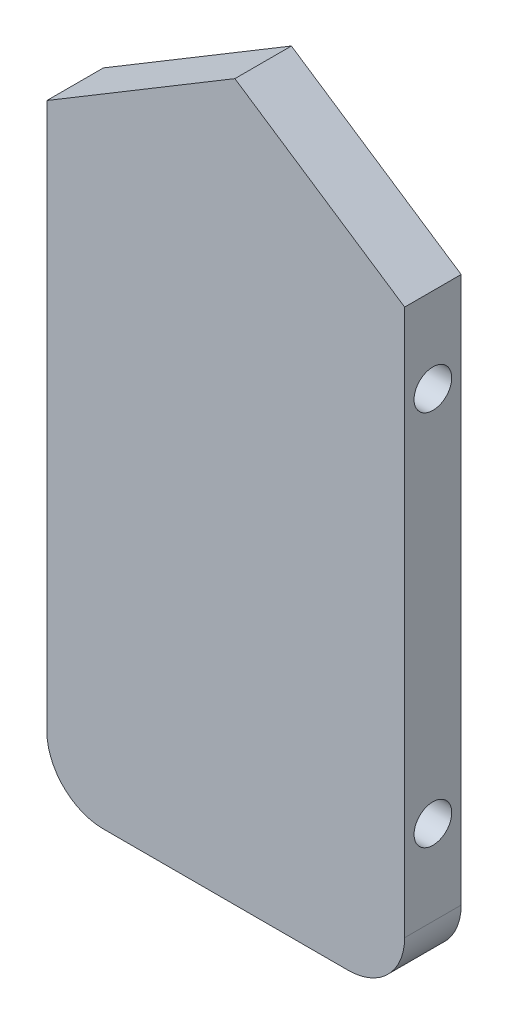
from build123d import *

# Parameters (mm, degrees)
BOSS_EXTRUDE1_DEPTH = 38.1
SKETCH4_R           = 25.4
CUT_EXTRUDE1_DEPTH  = 684.562089353


with BuildPart() as part:
    # Sketch3 → Boss-Extrude1 (new, symmetric)
    with BuildSketch(Plane.XY):
        with BuildLine():
            Line((-228.6, -406.4), (-228.6, 330.2))
            Line((-228.6, 330.2), (25.03619311, 482.6))
            Line((25.03619311, 482.6), (254, 330.2))
            Line((254, 330.2), (254, -406.4))
            ThreePointArc((254, -406.4), (231.681536726, -460.281536726), (177.8, -482.6))
            Line((177.8, -482.6), (-152.4, -482.6))
            ThreePointArc((-152.4, -482.6), (-206.281536726, -460.281536726), (-228.6, -406.4))
        make_face()
    extrude(amount=BOSS_EXTRUDE1_DEPTH, both=True)

    # Sketch4 → Cut-Extrude1 (cut, through all)
    with BuildSketch(Plane.ZY.offset(228.6)):
        with Locations((0, 215.9)):
            Circle(SKETCH4_R)
        with Locations((0, -292.1)):
            Circle(SKETCH4_R)
    extrude(amount=-CUT_EXTRUDE1_DEPTH, mode=Mode.SUBTRACT)


solid = part.part
